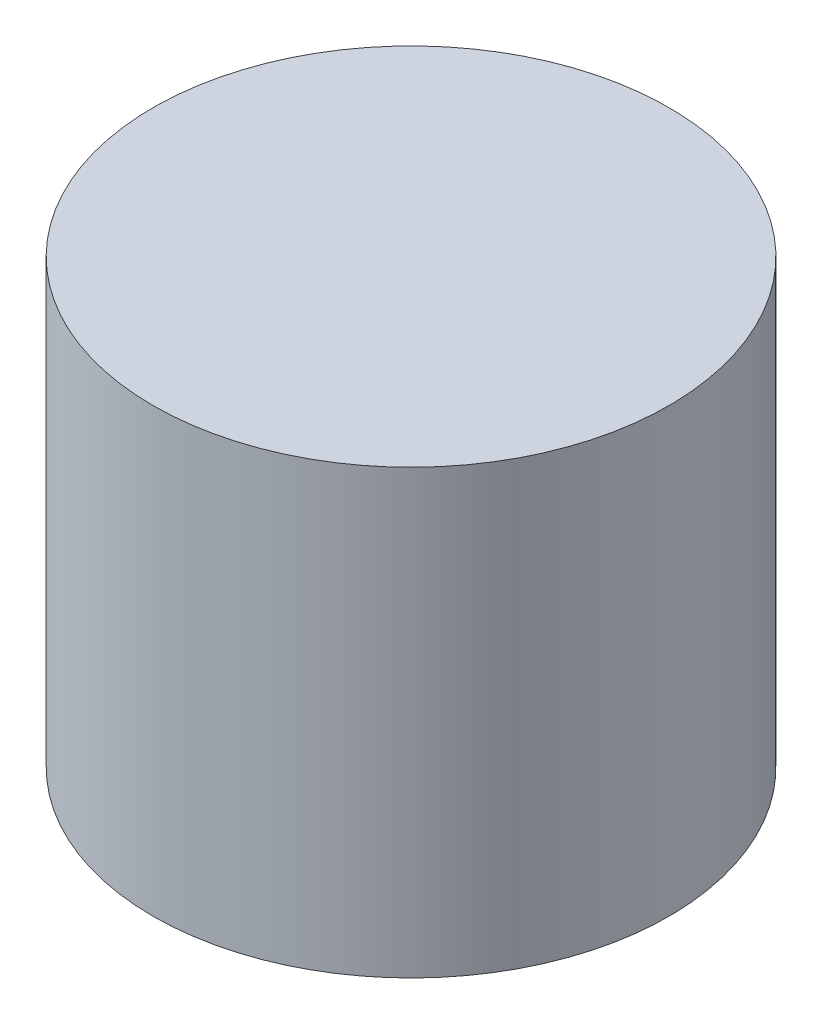
from build123d import *

# Parameters (mm, degrees)
SKETCH1_R           = 1.75
BOSS_EXTRUDE1_DEPTH = 3


with BuildPart() as part:
    # Sketch1 → Boss-Extrude1 (new body)
    with BuildSketch(Plane(origin=(0, 0, 0), x_dir=(1, 0, 0), z_dir=(0, 1, 0))):
        with Locations(Location((0, 0, 0), (0, 0, 270))):
            Circle(SKETCH1_R)
    extrude(amount=BOSS_EXTRUDE1_DEPTH)


solid = part.part
